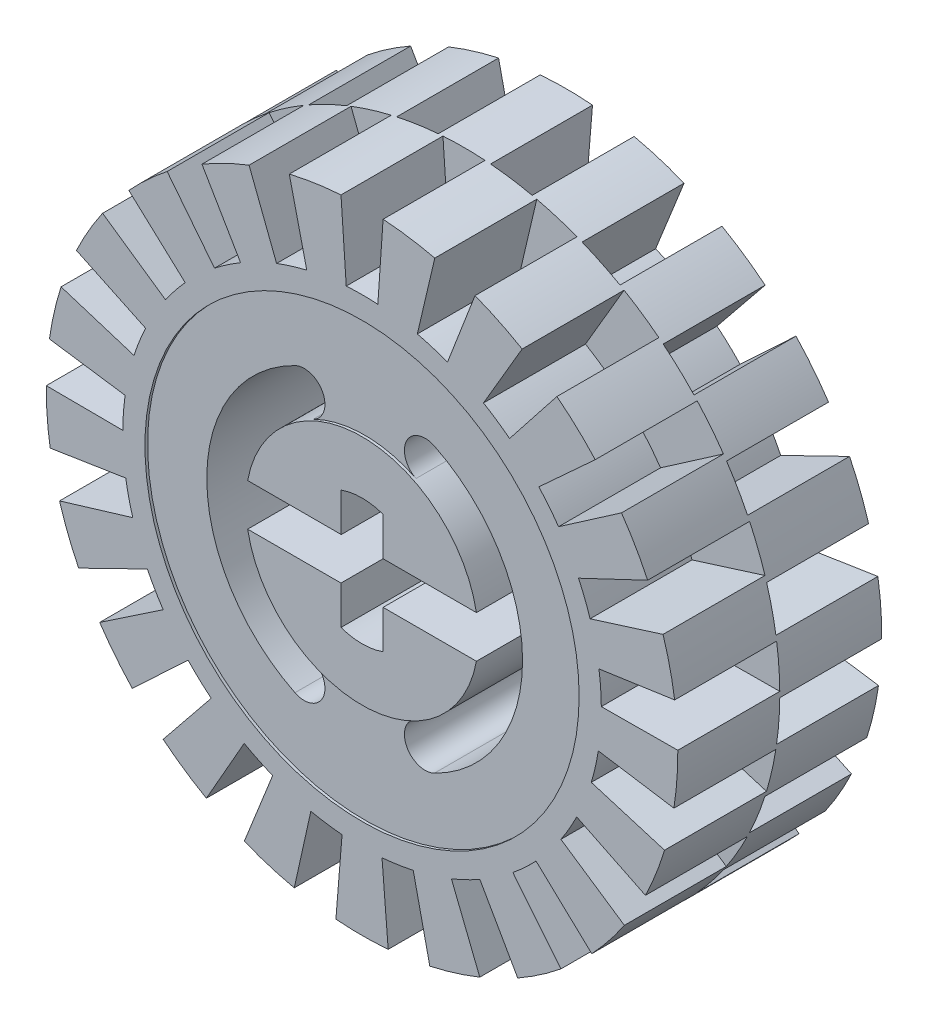
from build123d import *
from build123d.topology import SkipClean

# Parameters (mm, degrees)
ESQUISSE1_R             = 12
BOSS_EXTRU_1_DEPTH      = 7.75
ENL_V_MAT_EXTRU_1_DEPTH = 3.875
ENL_V_MAT_EXTRU_2_DEPTH = 3.875
ENL_V_MAT_EXTRU_3_REACH = 20.656
ESQUISSE5_R             = 8.25
ESQUISSE5_R_2           = 4.42
ENL_V_MAT_EXTRU_4_DEPTH = 0.1
ENL_V_START             = -0.1
ESQUISSE6_R             = 8.25
ESQUISSE6_R_2           = 4.42
ENL_V_MAT_EXTRU_5_DEPTH = 0.1


with BuildPart() as part:
    # Esquisse1 → Boss.-Extru.1 (new body)
    with BuildSketch(Plane.XY):
        Circle(ESQUISSE1_R)
    extrude(amount=BOSS_EXTRU_1_DEPTH)

    # Esquisse2 → Enlèv. mat.-Extru.1 (cut)
    with BuildSketch(Plane.XY.offset(7.75)):
        with BuildLine():
            Line((-0.8, 11.973303638), (-0.6, 9.073303638))
            ThreePointArc((-0.6, 9.073303638), (0, 9.093120416), (0.6, 9.073303638))
            Line((0.6, 9.073303638), (0.8, 11.973303638))
            Line((0.8, 11.973303638), (1.216363407, 18.010573039))
            Line((1.216363407, 18.010573039), (-1.216363407, 18.010573039))
            Line((-1.216363407, 18.010573039), (-0.8, 11.973303638))
        make_face()
        with BuildLine():
            Line((2.764734957, 11.677167491), (2.101059513, 8.847055319))
            ThreePointArc((2.101059513, 8.847055319), (2.680244294, 8.689138589), (3.24774688, 8.49334911))
            Line((3.24774688, 8.49334911), (4.293651447, 11.205559212))
            Line((4.293651447, 11.205559212), (6.471033391, 16.851884405))
            Line((6.471033391, 16.851884405), (4.146385804, 17.568943221))
            Line((4.146385804, 17.568943221), (2.764734957, 11.677167491))
        make_face()
        with BuildLine():
            Line((6.083811081, 10.343463769), (4.615430667, 7.834707311))
            ThreePointArc((4.615430667, 7.834707311), (5.122337121, 7.513088667), (5.606917197, 7.158723242))
            Line((5.606917197, 7.158723242), (7.40579312, 9.442151676))
            Line((7.40579312, 9.442151676), (11.150723661, 14.195831888))
            Line((11.150723661, 14.195831888), (9.14071044, 15.566235698))
            Line((9.14071044, 15.566235698), (6.083811081, 10.343463769))
        make_face()
        with BuildLine():
            Line((8.862313892, 8.090697899), (6.719700553, 6.126211177))
            ThreePointArc((6.719700553, 6.126211177), (7.109287815, 5.669467847), (7.467888315, 5.188013398))
            Line((7.467888315, 5.188013398), (9.859897575, 6.839767527))
            Line((9.859897575, 6.839767527), (14.839623199, 10.27841741))
            Line((14.839623199, 10.27841741), (13.32284284, 12.180399821))
            Line((13.32284284, 12.180399821), (8.862313892, 8.090697899))
        make_face()
        with BuildLine():
            Line((10.853361221, 5.119038015), (8.226895555, 3.873374295))
            ThreePointArc((8.226895555, 3.873374295), (8.464547089, 3.322089928), (8.665304784, 2.756325796))
            Line((8.665304784, 2.756325796), (11.43790686, 3.629640017))
            Line((11.43790686, 3.629640017), (17.209957093, 5.447720439))
            Line((17.209957093, 5.447720439), (16.321182187, 7.712281968))
            Line((16.321182187, 7.712281968), (10.853361221, 5.119038015))
        make_face()
        with BuildLine():
            Line((11.880039777, 1.692529139), (9.003094784, 1.276371108))
            ThreePointArc((9.003094784, 1.276371108), (9.067694207, 0.67952974), (9.092770897, 0.079726552))
            Line((9.092770897, 0.079726552), (11.999607927, 0.097003064))
            Line((11.999607927, 0.097003064), (18.051110775, 0.132969601))
            Line((18.051110775, 0.132969601), (17.869312873, 2.558894017))
            Line((17.869312873, 2.558894017), (11.880039777, 1.692529139))
        make_face()
        with BuildLine():
            Line((11.851124665, -1.884368378), (8.979329532, -1.434043252))
            ThreePointArc((8.979329532, -1.434043252), (8.865136902, -2.023409648), (8.712304412, -2.603956747))
            Line((8.712304412, -2.603956747), (11.49509117, -3.444253038))
            Line((11.49509117, -3.444253038), (17.288344049, -5.193596171))
            Line((17.288344049, -5.193596171), (17.829676692, -2.821862897))
            Line((17.829676692, -2.821862897), (11.851124665, -1.884368378))
        make_face()
        with BuildLine():
            Line((10.769185117, -5.293831496), (8.157711446, -4.017036577))
            ThreePointArc((8.157711446, -4.017036577), (7.87487328, -4.546560208), (7.557711446, -5.056267061))
            Line((7.557711446, -5.056267061), (9.969185117, -6.679472142))
            Line((9.969185117, -6.679472142), (14.989432085, -10.05868813))
            Line((14.989432085, -10.05868813), (16.205795492, -7.951884909))
            Line((16.205795492, -7.951884909), (10.769185117, -5.293831496))
        make_face()
        with BuildLine():
            Line((8.730356213, -8.232914453), (6.611244899, -6.243098573))
            ThreePointArc((6.611244899, -6.243098573), (6.184892608, -6.665728942), (5.731582653, -7.059305858))
            Line((5.731582653, -7.059305858), (7.557473218, -9.321190834))
            Line((7.557473218, -9.321190834), (11.358643301, -14.030021508))
            Line((11.358643301, -14.030021508), (13.141958245, -12.37534705))
            Line((13.141958245, -12.37534705), (8.730356213, -8.232914453))
        make_face()
        with BuildLine():
            Line((5.915796846, -10.440466832), (4.477340229, -7.914433863))
            ThreePointArc((4.477340229, -7.914433863), (3.945357086, -8.192618407), (3.396177588, -8.43509435))
            Line((3.396177588, -8.43509435), (4.474246658, -11.134680815))
            Line((4.474246658, -11.134680815), (6.718589212, -16.754725905))
            Line((6.718589212, -16.754725905), (8.910400336, -15.699205298))
            Line((8.910400336, -15.699205298), (5.915796846, -10.440466832))
        make_face()
        with BuildLine():
            Line((2.575592969, -11.720337916), (1.945604232, -8.882536973))
            ThreePointArc((1.945604232, -8.882536973), (1.355259273, -8.991557774), (0.75900724, -9.061387692))
            Line((0.75900724, -9.061387692), (0.993463647, -11.958805542))
            Line((0.993463647, -11.958805542), (1.481558988, -17.990699378))
            Line((1.481558988, -17.990699378), (3.887114254, -17.62812026))
            Line((3.887114254, -17.62812026), (2.575592969, -11.720337916))
        make_face()
        with BuildLine():
            Line((-0.993463647, -11.958805542), (-0.75900724, -9.061387692))
            ThreePointArc((-0.75900724, -9.061387692), (-1.355259273, -8.991557774), (-1.945604232, -8.882536973))
            Line((-1.945604232, -8.882536973), (-2.575592969, -11.720337916))
            Line((-2.575592969, -11.720337916), (-3.887114254, -17.62812026))
            Line((-3.887114254, -17.62812026), (-1.481558988, -17.990699378))
            Line((-1.481558988, -17.990699378), (-0.993463647, -11.958805542))
        make_face()
        with BuildLine():
            Line((-4.474246658, -11.134680815), (-3.396177588, -8.43509435))
            ThreePointArc((-3.396177588, -8.43509435), (-3.945357086, -8.192618407), (-4.477340229, -7.914433863))
            Line((-4.477340229, -7.914433863), (-5.915796846, -10.440466832))
            Line((-5.915796846, -10.440466832), (-8.910400336, -15.699205298))
            Line((-8.910400336, -15.699205298), (-6.718589212, -16.754725905))
            Line((-6.718589212, -16.754725905), (-4.474246658, -11.134680815))
        make_face()
        with BuildLine():
            Line((-7.557473218, -9.321190834), (-5.731582653, -7.059305858))
            ThreePointArc((-5.731582653, -7.059305858), (-6.184892608, -6.665728942), (-6.611244899, -6.243098573))
            Line((-6.611244899, -6.243098573), (-8.730356213, -8.232914453))
            Line((-8.730356213, -8.232914453), (-13.141958245, -12.37534705))
            Line((-13.141958245, -12.37534705), (-11.358643301, -14.030021508))
            Line((-11.358643301, -14.030021508), (-7.557473218, -9.321190834))
        make_face()
        with BuildLine():
            Line((-9.969185117, -6.679472142), (-7.557711446, -5.056267061))
            ThreePointArc((-7.557711446, -5.056267061), (-7.87487328, -4.546560208), (-8.157711446, -4.017036577))
            Line((-8.157711446, -4.017036577), (-10.769185117, -5.293831496))
            Line((-10.769185117, -5.293831496), (-16.205795492, -7.951884909))
            Line((-16.205795492, -7.951884909), (-14.989432085, -10.05868813))
            Line((-14.989432085, -10.05868813), (-9.969185117, -6.679472142))
        make_face()
        with BuildLine():
            Line((-11.49509117, -3.444253038), (-8.712304412, -2.603956747))
            ThreePointArc((-8.712304412, -2.603956747), (-8.865136902, -2.023409648), (-8.979329532, -1.434043252))
            Line((-8.979329532, -1.434043252), (-11.851124665, -1.884368378))
            Line((-11.851124665, -1.884368378), (-17.829676692, -2.821862897))
            Line((-17.829676692, -2.821862897), (-17.288344049, -5.193596171))
            Line((-17.288344049, -5.193596171), (-11.49509117, -3.444253038))
        make_face()
        with BuildLine():
            Line((-11.999607927, 0.097003064), (-9.092770897, 0.079726552))
            ThreePointArc((-9.092770897, 0.079726552), (-9.067694207, 0.67952974), (-9.003094784, 1.276371108))
            Line((-9.003094784, 1.276371108), (-11.880039777, 1.692529139))
            Line((-11.880039777, 1.692529139), (-17.869312873, 2.558894017))
            Line((-17.869312873, 2.558894017), (-18.051110775, 0.132969601))
            Line((-18.051110775, 0.132969601), (-11.999607927, 0.097003064))
        make_face()
        with BuildLine():
            Line((-11.43790686, 3.629640017), (-8.665304784, 2.756325796))
            ThreePointArc((-8.665304784, 2.756325796), (-8.464547089, 3.322089928), (-8.226895555, 3.873374295))
            Line((-8.226895555, 3.873374295), (-10.853361221, 5.119038015))
            Line((-10.853361221, 5.119038015), (-16.321182187, 7.712281968))
            Line((-16.321182187, 7.712281968), (-17.209957093, 5.447720439))
            Line((-17.209957093, 5.447720439), (-11.43790686, 3.629640017))
        make_face()
        with BuildLine():
            Line((-9.859897575, 6.839767527), (-7.467888315, 5.188013398))
            ThreePointArc((-7.467888315, 5.188013398), (-7.109287815, 5.669467847), (-6.719700553, 6.126211177))
            Line((-6.719700553, 6.126211177), (-8.862313892, 8.090697899))
            Line((-8.862313892, 8.090697899), (-13.32284284, 12.180399821))
            Line((-13.32284284, 12.180399821), (-14.839623199, 10.27841741))
            Line((-14.839623199, 10.27841741), (-9.859897575, 6.839767527))
        make_face()
        with BuildLine():
            Line((-7.40579312, 9.442151676), (-5.606917197, 7.158723242))
            ThreePointArc((-5.606917197, 7.158723242), (-5.122337121, 7.513088667), (-4.615430667, 7.834707311))
            Line((-4.615430667, 7.834707311), (-6.083811081, 10.343463769))
            Line((-6.083811081, 10.343463769), (-9.14071044, 15.566235698))
            Line((-9.14071044, 15.566235698), (-11.150723661, 14.195831888))
            Line((-11.150723661, 14.195831888), (-7.40579312, 9.442151676))
        make_face()
        with BuildLine():
            Line((-4.293651447, 11.205559212), (-3.24774688, 8.49334911))
            ThreePointArc((-3.24774688, 8.49334911), (-2.680244294, 8.689138589), (-2.101059513, 8.847055319))
            Line((-2.101059513, 8.847055319), (-2.764734957, 11.677167491))
            Line((-2.764734957, 11.677167491), (-4.146385804, 17.568943221))
            Line((-4.146385804, 17.568943221), (-6.471033391, 16.851884405))
            Line((-6.471033391, 16.851884405), (-4.293651447, 11.205559212))
        make_face()
    extrude(amount=-ENL_V_MAT_EXTRU_1_DEPTH, mode=Mode.SUBTRACT)

    # Esquisse3 → Enlèv. mat.-Extru.2 (cut)
    with BuildSketch(Plane(origin=(0, 0, 0), x_dir=(-1, 0, 0), z_dir=(0, 0, -1))):
        with BuildLine():
            Line((1.150666399, 14.119005081), (0.747367591, 9.060034763))
            ThreePointArc((0.747367591, 9.060034763), (1.343706962, 8.990953221), (1.934186627, 8.88266347))
            Line((1.934186627, 8.88266347), (3.027609835, 13.838494005))
            Line((3.027609835, 13.838494005), (1.150666399, 14.119005081))
        make_face()
        with BuildLine():
            Line((5.261195324, 13.152572425), (3.384656273, 8.437232375))
            ThreePointArc((3.384656273, 8.437232375), (3.934139817, 8.195445817), (4.466467162, 7.917920138))
            Line((4.466467162, 7.917920138), (6.972069338, 12.331284879))
            Line((6.972069338, 12.331284879), (5.261195324, 13.152572425))
        make_face()
        with BuildLine():
            Line((8.904243957, 11.01747599), (5.721203391, 7.064744863))
            ThreePointArc((5.721203391, 7.064744863), (6.175007084, 6.671737086), (6.60188249, 6.249634855))
            Line((6.60188249, 6.249634855), (10.297029885, 9.728386977))
            Line((10.297029885, 9.728386977), (8.904243957, 11.01747599))
        make_face()
        with BuildLine():
            Line((11.756111438, 7.903428464), (7.549396481, 5.064523768))
            ThreePointArc((7.549396481, 5.064523768), (7.867197873, 4.555215236), (8.150691586, 4.026042089))
            Line((8.150691586, 4.026042089), (12.707054139, 6.2610792))
            Line((12.707054139, 6.2610792), (11.756111438, 7.903428464))
        make_face()
        with BuildLine():
            Line((13.563396827, 4.087126635), (8.706792564, 2.61429751))
            ThreePointArc((8.706792564, 2.61429751), (8.860353607, 2.033942523), (8.975275966, 1.444717815))
            Line((8.975275966, 1.444717815), (13.988000868, 2.237447059))
            Line((13.988000868, 2.237447059), (13.563396827, 4.087126635))
        make_face()
        with BuildLine():
            Line((14.165514887, -0.092334331), (9.090551919, -0.068220554))
            ThreePointArc((9.090551919, -0.068220554), (9.06622804, -0.668054909), (9.002367689, -1.264975976))
            Line((9.002367689, -1.264975976), (14.026052335, -1.984992071))
            Line((14.026052335, -1.984992071), (14.165514887, -0.092334331))
        make_face()
        with BuildLine():
            Line((13.508964784, -4.263590987), (8.666575842, -2.744676922))
            ThreePointArc((8.666575842, -2.744676922), (8.466528325, -3.310692731), (8.229559537, -3.862271101))
            Line((8.229559537, -3.862271101), (12.8178275, -6.031055945))
            Line((12.8178275, -6.031055945), (13.508964784, -4.263590987))
        make_face()
        with BuildLine():
            Line((11.652083876, -8.056008873), (7.472536469, -5.177256701))
            ThreePointArc((7.472536469, -5.177256701), (7.114540413, -5.659160975), (6.725518905, -6.11638649))
            Line((6.725518905, -6.11638649), (10.470682441, -9.541234032))
            Line((10.470682441, -9.541234032), (11.652083876, -8.056008873))
        make_face()
        with BuildLine():
            Line((8.759864183, -11.132615018), (5.614529438, -7.149814503))
            ThreePointArc((5.614529438, -7.149814503), (5.130394364, -7.504787932), (4.623886404, -7.827034097))
            Line((4.623886404, -7.827034097), (7.193171297, -12.203631604))
            Line((7.193171297, -12.203631604), (8.759864183, -11.132615018))
        make_face()
        with BuildLine():
            Line((5.089292114, -13.220039463), (3.257646827, -8.487079909))
            ThreePointArc((3.257646827, -8.487079909), (2.690390262, -8.683581546), (2.111401304, -8.842215376))
            Line((2.111401304, -8.842215376), (3.276515317, -13.781682953))
            Line((3.276515317, -13.781682953), (5.089292114, -13.220039463))
        make_face()
        with BuildLine():
            Line((0.966514107, -14.132805387), (0.611308, -9.07023102))
            ThreePointArc((0.611308, -9.07023102), (0.011333178, -9.090800833), (-0.588691067, -9.071727016))
            Line((-0.588691067, -9.071727016), (-0.931273427, -14.135171291))
            Line((-0.931273427, -14.135171291), (0.966514107, -14.132805387))
        make_face()
        with BuildLine():
            Line((-3.242142919, -13.789809532), (-2.089348225, -8.847452301))
            ThreePointArc((-2.089348225, -8.847452301), (-2.668730909, -8.690262572), (-3.236475654, -8.4951759))
            Line((-3.236475654, -8.4951759), (-5.056314441, -13.23268763))
            Line((-5.056314441, -13.23268763), (-3.242142919, -13.789809532))
        make_face()
        with BuildLine():
            Line((-7.16272132, -12.221528584), (-4.604356692, -7.838538619))
            ThreePointArc((-4.604356692, -7.838538619), (-5.111666542, -7.517556344), (-5.596685175, -7.163791125))
            Line((-5.596685175, -7.163791125), (-8.732079728, -11.154421601))
            Line((-8.732079728, -11.154421601), (-7.16272132, -12.221528584))
        make_face()
        with BuildLine():
            Line((-10.446860498, -9.567311188), (-6.710247861, -6.133136382))
            ThreePointArc((-6.710247861, -6.133136382), (-7.100408172, -5.676882245), (-7.459604658, -5.19587207))
            Line((-7.459604658, -5.19587207), (-11.63196141, -8.085036263))
            Line((-11.63196141, -8.085036263), (-10.446860498, -9.567311188))
        make_face()
        with BuildLine():
            Line((-12.802750276, -6.062996207), (-8.21990406, -3.882778062))
            ThreePointArc((-8.21990406, -3.882778062), (-8.458247375, -3.331792246), (-8.659705532, -2.76627698))
            Line((-8.659705532, -2.76627698), (-13.498292275, -4.297259973))
            Line((-13.498292275, -4.297259973), (-12.802750276, -6.062996207))
        make_face()
        with BuildLine():
            Line((-14.021059507, -2.019957407), (-8.999185711, -1.287417872))
            ThreePointArc((-8.999185711, -1.287417872), (-9.064534181, -0.690657885), (-9.090353566, -0.090886041))
            Line((-9.090353566, -0.090886041), (-14.165240636, -0.127653276))
            Line((-14.165240636, -0.127653276), (-14.021059507, -2.019957407))
        make_face()
        with BuildLine():
            Line((-13.993536071, 2.202563473), (-8.978850219, 1.422335045))
            ThreePointArc((-8.978850219, 1.422335045), (-8.865397346, 2.011844461), (-8.713283794, 2.592580521))
            Line((-8.713283794, 2.592580521), (-13.573545203, 4.053295975))
            Line((-13.573545203, 4.053295975), (-13.993536071, 2.202563473))
        make_face()
        with BuildLine():
            Line((-12.722625546, 6.229376923), (-8.160704482, 4.005707252))
            ThreePointArc((-8.160704482, 4.005707252), (-7.878531051, 4.535585597), (-7.562000519, 5.045684927))
            Line((-7.562000519, 5.045684927), (-11.775780711, 7.874092091))
            Line((-11.775780711, 7.874092091), (-12.722625546, 6.229376923))
        make_face()
        with BuildLine():
            Line((-10.321253908, 9.702682897), (-6.617444339, 6.233154791))
            ThreePointArc((-6.617444339, 6.233154791), (-6.191622698, 6.656320049), (-5.738800312, 7.050458085))
            Line((-5.738800312, 7.050458085), (-8.931686427, 10.99524057))
            Line((-8.931686427, 10.99524057), (-10.321253908, 9.702682897))
        make_face()
        with BuildLine():
            Line((-7.002793567, 12.313862915), (-4.486195227, 7.906759173))
            ThreePointArc((-4.486195227, 7.906759173), (-3.954561497, 8.185611254), (-3.405682514, 8.428767101))
            Line((-3.405682514, 8.428767101), (-5.293972607, 13.139413673))
            Line((-5.293972607, 13.139413673), (-7.002793567, 12.313862915))
        make_face()
        with BuildLine():
            Line((-3.062104286, 13.830902175), (-1.956327981, 8.877813304))
            ThreePointArc((-1.956327981, 8.877813304), (-1.366120153, 8.987574976), (-0.769954878, 9.058143172))
            Line((-0.769954878, 9.058143172), (-1.18586609, 14.116092209))
            Line((-1.18586609, 14.116092209), (-3.062104286, 13.830902175))
        make_face()
    extrude(amount=-ENL_V_MAT_EXTRU_2_DEPTH, mode=Mode.SUBTRACT)

    # Esquisse4 → Enlèv. mat.-Extru.3 (cut, up to next)
    with BuildSketch(Plane(origin=(0, 0, 0), x_dir=(-1, 0, 0), z_dir=(0, 0, -1)), mode=Mode.PRIVATE) as enl_v_mat_extru_3_sk1:
        with BuildLine():
            Line((-4.346998965, 0.8), (-0.79, 0.8))
            Line((-0.79, 0.8), (-0.79, 2.266252413))
            ThreePointArc((-0.79, 2.266252413), (0, 2.4), (0.79, 2.266252413))
            Line((0.79, 2.266252413), (0.79, 0.8))
            Line((0.79, 0.8), (4.346998965, 0.8))
            ThreePointArc((4.346998965, 0.8), (3.524605207, 2.667125445), (1.951247601, 3.965984468))
            ThreePointArc((1.951247601, 3.965984468), (1.591147572, 5.023589295), (2.648752399, 5.383689323))
            ThreePointArc((2.648752399, 5.383689323), (6, 0), (2.648752399, -5.383689323))
            ThreePointArc((2.648752399, -5.383689323), (1.591147572, -5.023589295), (1.951247601, -3.965984468))
            ThreePointArc((1.951247601, -3.965984468), (3.524605207, -2.667125445), (4.346998965, -0.8))
            Line((4.346998965, -0.8), (0.8, -0.8))
            Line((0.8, -0.8), (0.8, -2.2627417))
            ThreePointArc((0.8, -2.2627417), (0, -2.4), (-0.8, -2.2627417))
            Line((-0.8, -2.2627417), (-0.8, -0.8))
            Line((-0.8, -0.8), (-4.346998965, -0.8))
            ThreePointArc((-4.346998965, -0.8), (-3.524605207, -2.667125445), (-1.951247601, -3.965984468))
            ThreePointArc((-1.951247601, -3.965984468), (-1.591147572, -5.023589295), (-2.648752399, -5.383689323))
            ThreePointArc((-2.648752399, -5.383689323), (-6, 0), (-2.648752399, 5.383689323))
            ThreePointArc((-2.648752399, 5.383689323), (-1.591147572, 5.023589295), (-1.951247601, 3.965984468))
            ThreePointArc((-1.951247601, 3.965984468), (-3.524605207, 2.667125445), (-4.346998965, 0.8))
        make_face()
    enl_v_mat_extru_3_tool1 = extrude(enl_v_mat_extru_3_sk1.sketch, amount=-ENL_V_MAT_EXTRU_3_REACH, mode=Mode.PRIVATE) & part.part
    add(enl_v_mat_extru_3_tool1.solids().sort_by_distance((0, -0.000753, 0))[0], mode=Mode.SUBTRACT)

    # Esquisse5 → Enlèv. mat.-Extru.4 (cut)
    with BuildSketch(Plane(origin=(0, 0, 0), x_dir=(-1, 0, 0), z_dir=(0, 0, -1))):
        Circle(ESQUISSE5_R)
        Circle(ESQUISSE5_R_2, mode=Mode.SUBTRACT)
    extrude(amount=-ENL_V_MAT_EXTRU_4_DEPTH, mode=Mode.SUBTRACT)

    # Esquisse6 → Enlèv. mat.-Extru.5 (cut)
    with SkipClean():  # the faces are left unmerged after this step: merging them gives an invalid solid
        with BuildSketch(Plane.XY.offset(7.75).offset(ENL_V_START)):
            with Locations(Location((0, 0, 0), (0, 0, 180))):
                Circle(ESQUISSE6_R)
            Circle(ESQUISSE6_R_2, mode=Mode.SUBTRACT)
        extrude(amount=ENL_V_MAT_EXTRU_5_DEPTH, mode=Mode.SUBTRACT)


solid = part.part
